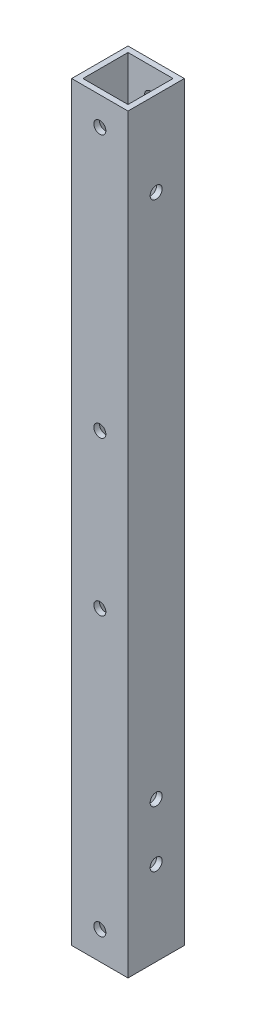
from build123d import *

# Parameters (mm, degrees)
SKETCH_1_W          = 15
SKETCH_1_H          = 15
SKETCH_1_W_2        = 12
SKETCH_1_H_2        = 12
EXTRUDE_1_DEPTH     = 200
SKETCH_2_R          = 1.6
CUT_EXTRUDE_1_DEPTH = 201.701893364
SKETCH_3_R          = 1.6
CUT_EXTRUDE_2_DEPTH = 201.701893364


with BuildPart() as part:
    # ｽｹｯﾁ1 → ﾎﾞｽ - 押し出し1 (new body)
    with BuildSketch(Plane(origin=(0, 0, 0), x_dir=(1, 0, 0), z_dir=(0, 1, 0))):
        Rectangle(SKETCH_1_W, SKETCH_1_H)
        Rectangle(SKETCH_1_W_2, SKETCH_1_H_2, mode=Mode.SUBTRACT)
    extrude(amount=EXTRUDE_1_DEPTH)

    # ｽｹｯﾁ2 → ｶｯﾄ - 押し出し1 (cut, through all)
    with BuildSketch(Plane.XY.offset(7.5)):
        with Locations((0, 192.5)):
            Circle(SKETCH_2_R)
        with Locations((0, 7.5)):
            Circle(SKETCH_2_R)
        with Locations((0, 122.5)):
            Circle(SKETCH_2_R)
        with Locations((0, 81.5)):
            Circle(SKETCH_2_R)
    extrude(amount=-CUT_EXTRUDE_1_DEPTH, mode=Mode.SUBTRACT)

    # ｽｹｯﾁ3 → ｶｯﾄ - 押し出し2 (cut, through all)
    with BuildSketch(Plane(origin=(7.5, 0, 0), x_dir=(0, 0, -1), z_dir=(1, 0, 0))):
        with Locations((0, 177.5)):
            Circle(SKETCH_3_R)
        with Locations((0, 22.5)):
            Circle(SKETCH_3_R)
        with Locations((0, 37.5)):
            Circle(SKETCH_3_R)
    extrude(amount=-CUT_EXTRUDE_2_DEPTH, mode=Mode.SUBTRACT)


solid = part.part
